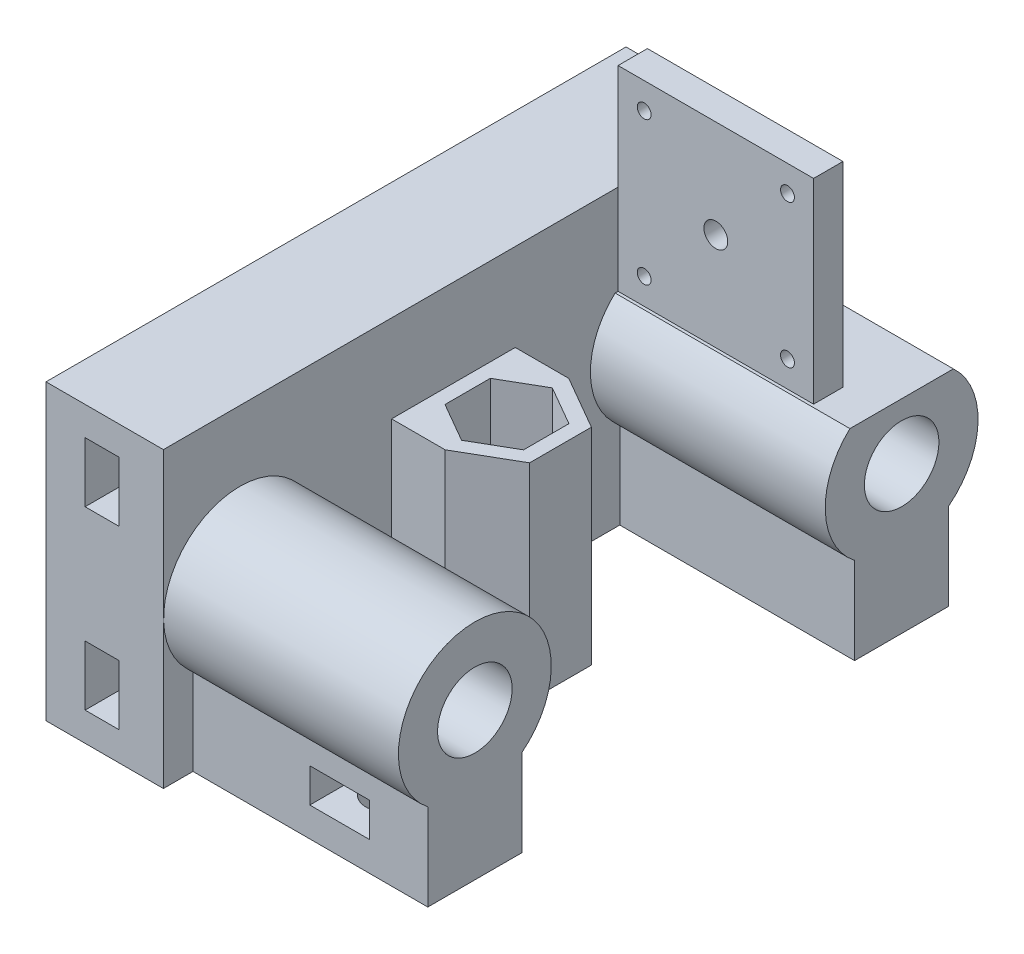
from build123d import *

# Parameters (mm, degrees)
SKETCH1_W               = 88.9
SKETCH1_H               = 76.2
BOSS_EXTRUDE1_DEPTH     = 25.4
SKETCH2_R               = 4.1021
CUT_EXTRUDE1_DEPTH      = 19.05
SKETCH5_W               = 88.9
SKETCH5_H               = 0.127
BOSS_EXTRUDE2_DEPTH     = 50.8
SKETCH6_R               = 16.53116582
SKETCH6_R_2             = 8.0645
BOSS_EXTRUDE3_DEPTH     = 50.8
BOSS_EXTRUDE4_DEPTH     = 18.288
SKETCH8_W               = 50.8
SKETCH8_H               = 20.36233164
BOSS_EXTRUDE5_DEPTH     = 27.94
CUT_EXTRUDE6_REACH      = 153.994
CUT_EXTRUDE6_END_RADIUS = 8.0645
SKETCH13_W              = 6.477
SKETCH13_H              = 7.366
CUT_EXTRUDE7_DEPTH      = 22.9616
BOSS_EXTRUDE6_DEPTH     = 50.8
CUT_EXTRUDE8_REACH      = 153.93
SKETCH14_3_R            = 5.25
CUT_EXTRUDE9_DEPTH      = 9
CUT_EXTRUDE10_REACH     = 153.93
SKETCH16_W              = 50.8
SKETCH16_H              = 6.39233418
BOSS_EXTRUDE7_DEPTH     = 50.8
BOSS_EXTRUDE9_START     = 19.05
BOSS_EXTRUDE9_DEPTH     = 19.05
SKETCH22_W              = 7.366
SKETCH22_H              = 12.954
CUT_EXTRUDE15_DEPTH     = 28.4988
MIRROR5_START           = 19.05
MIRROR5_COPY_1_DEPTH    = 19.05
MIRROR5_COPY_2_SKETCH_W = 7.366
MIRROR5_COPY_2_SKETCH_H = 12.954
MIRROR5_COPY_2_DEPTH    = 28.4988
SKETCH25_R              = 5.125
BOSS_EXTRUDE10_DEPTH    = 6.35
SKETCH26_W              = 25.4
SKETCH26_H              = 125.476
CUT_EXTRUDE16_DEPTH     = 6.35
CUT_EXTRUDE17_DEPTH     = 6.35
SKETCH30_W              = 22.38332306
SKETCH30_H              = 4.36456582
CUT_EXTRUDE18_DEPTH     = 50.8
SKETCH31_W              = 6.35
SKETCH31_H              = 42.299999982
BOSS_EXTRUDE13_DEPTH    = 42.3
SKETCH34_R              = 1.5
SKETCH34_R_2            = 2.575
CUT_EXTRUDE20_DEPTH     = 12.7
SKETCH34_4_R            = 11.075
SKETCH34_4_R_2          = 2.575
CUT_EXTRUDE21_DEPTH     = 2.1


with BuildPart() as part:
    # Sketch1 → Boss-Extrude1 (new body)
    with BuildSketch(Plane(origin=(0, 0, 0), x_dir=(0, 0, -1), z_dir=(1, 0, 0))):
        with Locations((44.45, 38.1)):
            Rectangle(SKETCH1_W, SKETCH1_H)
    extrude(amount=BOSS_EXTRUDE1_DEPTH)

    # Sketch2 → Cut-Extrude1 (cut)
    with BuildSketch(Plane.ZY):
        with Locations((-85.09, 19.05)):
            Circle(SKETCH2_R)
        with Locations((-3.81, 57.15)):
            Circle(SKETCH2_R)
        with Locations((-3.81, 19.05)):
            Circle(SKETCH2_R)
        with Locations((-85.09, 57.15)):
            Circle(SKETCH2_R)
    extrude(amount=-CUT_EXTRUDE1_DEPTH, mode=Mode.SUBTRACT)

    # Sketch5 → Boss-Extrude2 (add)
    with BuildSketch(Plane(origin=(25.4, 0, 0), x_dir=(0, 0, -1), z_dir=(1, 0, 0))):
        with Locations((44.45, 0.0635)):
            Rectangle(SKETCH5_W, SKETCH5_H)
    extrude(amount=BOSS_EXTRUDE2_DEPTH)

    # Sketch6 → Boss-Extrude3 (add)
    # profile 1 of 2: a face of its own
    with BuildSketch(Plane(origin=(25.4, 0, 0), x_dir=(0, 0, -1), z_dir=(1, 0, 0))):
        with Locations(Location((-1.7145, 38.1635, 0), (0, 0, 275.953033203))):
            Circle(SKETCH6_R)
        with Locations(Location((-1.7145, 38.1635, 0), (0, 0, 77.725329785))):
            Circle(SKETCH6_R_2, mode=Mode.SUBTRACT)
    # profile 2 of 2: a face of its own
    with BuildSketch(Plane(origin=(25.4, 0, 0), x_dir=(0, 0, -1), z_dir=(1, 0, 0))):
        with Locations(Location((90.6145, 38.1635, 0), (0, 0, 264.046966797))):
            Circle(SKETCH6_R)
        with Locations(Location((90.6145, 38.1635, 0), (0, 0, 102.274670215))):
            Circle(SKETCH6_R_2, mode=Mode.SUBTRACT)
    extrude(amount=BOSS_EXTRUDE3_DEPTH)

    # Sketch7 → Boss-Extrude4 (add)
    with BuildSketch(Plane.XY):
        Polygon((76.2, 0.127), (25.4, 0.127), (25.4, 76.2), (0, 76.2), (0, 58.670238274), (19.05, 58.670238274), (19.05, 55.629761726), (0, 55.629761726), (0, 20.570238274), (19.05, 20.570238274), (19.05, 17.529761726), (0, 17.529761726), (0, 0), (76.2, 0), align=None)
    boss_extrude4 = extrude(amount=BOSS_EXTRUDE4_DEPTH)

    # Mirror2: Boss-Extrude4 across plane
    add(boss_extrude4.mirror(Plane.XY.offset(-44.45)))

    # Sketch8 → Boss-Extrude5 (add)
    with BuildSketch(Plane(origin=(0, 0.127, 0), x_dir=(1, 0, 0), z_dir=(0, 1, 0))):
        with Locations((50.8, -1.7145)):
            Rectangle(SKETCH8_W, SKETCH8_H)
    boss_extrude5 = extrude(amount=BOSS_EXTRUDE5_DEPTH)

    # Cut-Extrude6: up to this cylinder (the profile starts outside it)
    cut_extrude6_end = Plane(origin=(57.15, 38.1635, 1.7145), z_dir=(-1, 0, 0)) * Cylinder(CUT_EXTRUDE6_END_RADIUS, 325.117, mode=Mode.PRIVATE)
    # Sketch12 → Cut-Extrude6 (cut, up to the surface)
    with BuildSketch(Plane.XZ, mode=Mode.PRIVATE) as cut_extrude6_sk1:
        with BuildLine():
            ThreePointArc((52.6669, 1.7145), (57.15, -2.7686), (61.6331, 1.7145))
            Line((61.6331, 1.7145), (52.6669, 1.7145))
        make_face()
    cut_extrude6_tool1 = extrude(cut_extrude6_sk1.sketch, amount=-CUT_EXTRUDE6_REACH, mode=Mode.PRIVATE) - cut_extrude6_end
    # Sketch12 → Cut-Extrude6 (cut, up to the surface)
    with BuildSketch(Plane.XZ, mode=Mode.PRIVATE) as cut_extrude6_sk2:
        with BuildLine():
            Line((52.6669, 1.7145), (61.6331, 1.7145))
            ThreePointArc((61.6331, 1.7145), (57.15, 6.1976), (52.6669, 1.7145))
        make_face()
    cut_extrude6_tool2 = extrude(cut_extrude6_sk2.sketch, amount=-CUT_EXTRUDE6_REACH, mode=Mode.PRIVATE) - cut_extrude6_end
    # Sketch12 → Cut-Extrude6 (cut, up to the surface)
    with BuildSketch(Plane.XZ, mode=Mode.PRIVATE) as cut_extrude6_sk3:
        with BuildLine():
            ThreePointArc((52.6669, 1.7145), (57.15, -2.7686), (61.6331, 1.7145))
            Line((61.6331, 1.7145), (52.6669, 1.7145))
        make_face()
    cut_extrude6_tool3 = extrude(cut_extrude6_sk3.sketch, amount=-CUT_EXTRUDE6_REACH, mode=Mode.PRIVATE) - cut_extrude6_end
    # Sketch12 → Cut-Extrude6 (cut, up to the surface)
    with BuildSketch(Plane.XZ, mode=Mode.PRIVATE) as cut_extrude6_sk4:
        with BuildLine():
            Line((52.6669, 1.7145), (61.6331, 1.7145))
            ThreePointArc((61.6331, 1.7145), (57.15, 6.1976), (52.6669, 1.7145))
        make_face()
    cut_extrude6_tool4 = extrude(cut_extrude6_sk4.sketch, amount=-CUT_EXTRUDE6_REACH, mode=Mode.PRIVATE) - cut_extrude6_end
    cut_extrude6 = cut_extrude6_tool1.solids().sort_by_distance((57.15, 0, -0.188187))[0] + cut_extrude6_tool2.solids().sort_by_distance((57.15, 0, 3.617187))[0] + cut_extrude6_tool3.solids().sort_by_distance((57.15, 0, -0.188187))[0] + cut_extrude6_tool4.solids().sort_by_distance((57.15, 0, 3.617187))[0]
    add(cut_extrude6, mode=Mode.SUBTRACT)

    # Sketch13 → Cut-Extrude7 (cut)
    with BuildSketch(Plane.XY.offset(18.288)):
        with Locations((60.3885, 16.383)):
            Rectangle(SKETCH13_W, SKETCH13_H)
        with Locations((53.9115, 16.383)):
            Rectangle(SKETCH13_W, SKETCH13_H)
    cut_extrude7 = extrude(amount=-CUT_EXTRUDE7_DEPTH, mode=Mode.SUBTRACT)

    # Mirror3: Boss-Extrude5, Cut-Extrude6, Cut-Extrude7 across plane
    add(boss_extrude5.mirror(Plane.XY.offset(-44.45)))
    add(cut_extrude6.mirror(Plane.XY.offset(-44.45)), mode=Mode.SUBTRACT)
    add(cut_extrude7.mirror(Plane.XY.offset(-44.45)), mode=Mode.SUBTRACT)

    # Sketch14 → Boss-Extrude6 (add)
    with BuildSketch(Plane(origin=(0, 0.127, 0), x_dir=(1, 0, 0), z_dir=(0, 1, 0))):
        Polygon((48.563230368, 37.763351356), (48.563230368, 51.136648644), (36.981615184, 57.823297288), (25.4, 51.136648644), (25.4, 37.763351356), (36.981615184, 31.076702712), align=None)
        Polygon((28.481615184, 49.357477288), (28.481615184, 39.542522712), (36.981615184, 34.635045424), (45.481615184, 39.542522712), (45.481615184, 49.357477288), (36.981615184, 54.264954576), align=None, mode=Mode.SUBTRACT)
    extrude(amount=BOSS_EXTRUDE6_DEPTH)

    # Sketch14<3> → Cut-Extrude8 (cut, up to next)
    with BuildSketch(Plane(origin=(0, 0.127, 0), x_dir=(1, 0, 0), z_dir=(0, 1, 0)), mode=Mode.PRIVATE) as cut_extrude8_sk1:
        with Locations(Location((36.981615184, 44.45, 0), (0, 0, 270))):
            Circle(SKETCH14_3_R)
    cut_extrude8_tool1 = extrude(cut_extrude8_sk1.sketch, amount=-CUT_EXTRUDE8_REACH, mode=Mode.PRIVATE) & part.part
    add(cut_extrude8_tool1.solids().sort_by_distance((36.981615, 0.127, -44.45))[0], mode=Mode.SUBTRACT)

    # Sketch15 → Cut-Extrude9 (cut)
    with BuildSketch(Plane.XZ):
        Polygon((45.531615184, -39.513655198), (36.981615184, -34.577310397), (28.431615184, -39.513655198), (28.431615184, -49.386344802), (36.981615184, -54.322689603), (45.531615184, -49.386344802), align=None)
    extrude(amount=-CUT_EXTRUDE9_DEPTH, mode=Mode.SUBTRACT)

    # Sketch16 → Cut-Extrude10 (cut, up to next)
    with BuildSketch(Plane(origin=(0, 0.127, 0), x_dir=(1, 0, 0), z_dir=(0, 1, 0)), mode=Mode.PRIVATE) as cut_extrude10_sk1:
        Polygon((48.563230368, 37.763351356), (36.981615184, 31.076702712), (25.4, 31.076702712), (25.4, 8.46666582), (76.2, 8.46666582), (76.2, 80.43333418), (25.4, 80.43333418), (25.4, 57.823297288), (36.981615184, 57.823297288), (48.563230368, 51.136648644), align=None)
    cut_extrude10_tool1 = extrude(cut_extrude10_sk1.sketch, amount=-CUT_EXTRUDE10_REACH, mode=Mode.PRIVATE) & part.part
    # Sketch16 → Cut-Extrude10 (cut, up to next)
    with BuildSketch(Plane(origin=(0, 0.127, 0), x_dir=(1, 0, 0), z_dir=(0, 1, 0)), mode=Mode.PRIVATE) as cut_extrude10_sk2:
        with Locations((50.8, -15.09183291)):
            Rectangle(SKETCH16_W, SKETCH16_H)
    cut_extrude10_tool2 = extrude(cut_extrude10_sk2.sketch, amount=-CUT_EXTRUDE10_REACH, mode=Mode.PRIVATE) & part.part
    # Sketch16 → Cut-Extrude10 (cut, up to next)
    with BuildSketch(Plane(origin=(0, 0.127, 0), x_dir=(1, 0, 0), z_dir=(0, 1, 0)), mode=Mode.PRIVATE) as cut_extrude10_sk3:
        with Locations((50.8, 103.99183291)):
            Rectangle(SKETCH16_W, SKETCH16_H)
    cut_extrude10_tool3 = extrude(cut_extrude10_sk3.sketch, amount=-CUT_EXTRUDE10_REACH, mode=Mode.PRIVATE) & part.part
    add(cut_extrude10_tool1.solids().sort_by_distance((53.397723, 0.127, -44.45))[0], mode=Mode.SUBTRACT)
    add(cut_extrude10_tool2.solids().sort_by_distance((50.8, 0.127, 15.091833))[0], mode=Mode.SUBTRACT)
    add(cut_extrude10_tool3.solids().sort_by_distance((50.8, 0.127, -103.991833))[0], mode=Mode.SUBTRACT)

    # Sketch18 → Boss-Extrude7 (add)
    with BuildSketch(Plane(origin=(0, 0.127, 0), x_dir=(1, 0, 0), z_dir=(0, 1, 0))):
        Polygon((36.981615184, 57.823297288), (25.4, 57.823297288), (25.4, 51.136648644), align=None)
        Polygon((25.4, 37.763351356), (25.4, 31.076702712), (36.981615184, 31.076702712), align=None)
    extrude(amount=BOSS_EXTRUDE7_DEPTH)

    # Sketch20 → Boss-Extrude9 (add)
    with BuildSketch(Plane.ZY.offset(-19.05).offset(BOSS_EXTRUDE9_START)):
        with BuildLine():
            ThreePointArc((0.2921, 19.05), (0.218413175, 18.275976935), (0, 17.529761726))
            Line((0, 17.529761726), (18.288, 17.529761726))
            Line((18.288, 17.529761726), (18.288, 20.570238274))
            Line((18.288, 20.570238274), (0, 20.570238274))
            ThreePointArc((0, 20.570238274), (0.218413175, 19.824023065), (0.2921, 19.05))
        make_face()
    boss_extrude9 = extrude(amount=-BOSS_EXTRUDE9_DEPTH)

    # Sketch22 → Cut-Extrude15 (cut)
    with BuildSketch(Plane.XY.offset(18.288)):
        with Locations((12.1412, 19.05)):
            Rectangle(SKETCH22_W, SKETCH22_H)
    cut_extrude15 = extrude(amount=-CUT_EXTRUDE15_DEPTH, mode=Mode.SUBTRACT)

    # Mirror4: Boss-Extrude9, Cut-Extrude15 across plane
    add(boss_extrude9.mirror(Plane.XY.offset(-44.45)))
    add(cut_extrude15.mirror(Plane.XY.offset(-44.45)), mode=Mode.SUBTRACT)

    # Mirror5: Boss-Extrude9, Cut-Extrude15 across plane
    add(boss_extrude9.mirror(Plane.ZX.offset(38.1)))
    add(cut_extrude15.mirror(Plane.ZX.offset(38.1)), mode=Mode.SUBTRACT)

    # Mirror5 copy 1 sketch → Mirror5 copy 1 (add)
    with BuildSketch(Plane(origin=(19.05, 76.2, -88.9), x_dir=(0, 0, -1), z_dir=(-1, 0, 0)).offset(MIRROR5_START)):
        with BuildLine():
            ThreePointArc((0.2921, 19.05), (0.218413175, 18.275976935), (0, 17.529761726))
            Line((0, 17.529761726), (18.288, 17.529761726))
            Line((18.288, 17.529761726), (18.288, 20.570238274))
            Line((18.288, 20.570238274), (0, 20.570238274))
            ThreePointArc((0, 20.570238274), (0.218413175, 19.824023065), (0.2921, 19.05))
        make_face()
    extrude(amount=-MIRROR5_COPY_1_DEPTH)

    # Mirror5 copy 2 sketch → Mirror5 copy 2 (cut)
    with BuildSketch(Plane(origin=(0, 76.2, -107.188), x_dir=(1, 0, 0), z_dir=(0, 0, -1))):
        with Locations((12.1412, 19.05)):
            Rectangle(MIRROR5_COPY_2_SKETCH_W, MIRROR5_COPY_2_SKETCH_H)
    extrude(amount=-MIRROR5_COPY_2_DEPTH, mode=Mode.SUBTRACT)

    # Sketch25 → Boss-Extrude10 (add)
    with BuildSketch(Plane(origin=(0, 15.350000034, 0), x_dir=(-1, 0, 0), z_dir=(0, -1, 0))):
        Polygon((-36.981615184, 34.577310397), (-28.431615184, 39.513655198), (-28.431615184, 49.386344802), (-36.981615184, 54.322689603), (-45.531615184, 49.386344802), (-45.531615184, 39.513655198), align=None)
        with Locations(Location((-36.981615184, 44.45, 0), (0, 0, 90))):
            Circle(SKETCH25_R, mode=Mode.SUBTRACT)
    extrude(amount=-BOSS_EXTRUDE10_DEPTH)

    # Sketch26 → Cut-Extrude16 (cut)
    with BuildSketch(Plane(origin=(0, 76.2, 0), x_dir=(1, 0, 0), z_dir=(0, 1, 0))):
        with Locations((12.7, 44.45)):
            Rectangle(SKETCH26_W, SKETCH26_H)
    extrude(amount=-CUT_EXTRUDE16_DEPTH, mode=Mode.SUBTRACT)

    # Sketch27 → Cut-Extrude17 (cut)
    with BuildSketch(Plane.XZ):
        Polygon((25.4, -107.188), (25.4, -100.79566582), (76.2, -100.79566582), (76.2, -80.43333418), (25.4, -80.43333418), (25.4, -57.823297288), (36.981615184, -57.823297288), (48.563230368, -51.136648644), (48.563230368, -37.763351356), (36.981615184, -31.076702712), (25.4, -31.076702712), (25.4, -8.46666582), (76.2, -8.46666582), (76.2, 11.89566582), (25.4, 11.89566582), (25.4, 18.288), (0, 18.288), (0, -107.188), align=None)
    extrude(amount=-CUT_EXTRUDE17_DEPTH, mode=Mode.SUBTRACT)

    # Sketch30 → Cut-Extrude18 (cut)
    with BuildSketch(Plane(origin=(76.2, 0, 0), x_dir=(0, 0, -1), z_dir=(1, 0, 0))):
        with Locations((90.6145, 52.51238291)):
            Rectangle(SKETCH30_W, SKETCH30_H)
    extrude(amount=-CUT_EXTRUDE18_DEPTH, mode=Mode.SUBTRACT)

    # Sketch31 → Boss-Extrude13 (add)
    with BuildSketch(Plane(origin=(25.4, 0, 0), x_dir=(0, 0, -1), z_dir=(1, 0, 0))):
        with Locations((83.243037579, 71.480099991)):
            Rectangle(SKETCH31_W, SKETCH31_H)
    extrude(amount=BOSS_EXTRUDE13_DEPTH)

    # Sketch34 → Cut-Extrude20 (cut)
    with BuildSketch(Plane(origin=(0, 0, -86.418037579), x_dir=(-1, 0, 0), z_dir=(0, 0, -1))):
        with Locations((-62.05, 55.9689)):
            Circle(SKETCH34_R)
        with Locations((-31.05, 55.9689)):
            Circle(SKETCH34_R)
        with Locations((-62.05, 86.9689)):
            Circle(SKETCH34_R)
        with Locations((-46.55, 71.480099991)):
            Circle(SKETCH34_R_2)
        with Locations((-31.05, 86.9689)):
            Circle(SKETCH34_R)
    extrude(amount=-CUT_EXTRUDE20_DEPTH, mode=Mode.SUBTRACT)

    # Sketch34<4> → Cut-Extrude21 (cut)
    with BuildSketch(Plane(origin=(0, 0, -86.418037579), x_dir=(-1, 0, 0), z_dir=(0, 0, -1))):
        with Locations((-46.55, 71.480099991)):
            Circle(SKETCH34_4_R)
        with Locations((-46.55, 71.480099991)):
            Circle(SKETCH34_4_R_2, mode=Mode.SUBTRACT)
    extrude(amount=-CUT_EXTRUDE21_DEPTH, mode=Mode.SUBTRACT)


solid = part.part
